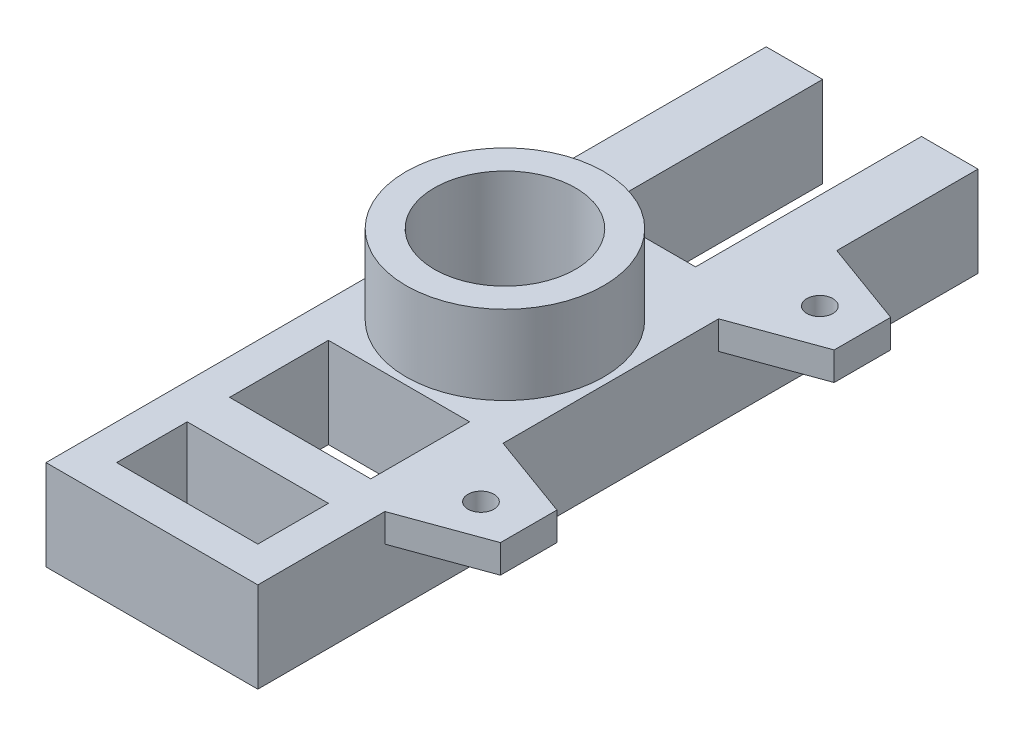
from build123d import *

# Parameters (mm, degrees)
SKETCH1_W           = 63.5
SKETCH1_H           = 31.75
SKETCH1_H_2         = 44.45
SKETCH1_R           = 44.45
BOSS_EXTRUDE1_DEPTH = 40.64
SKETCH1_3_R         = 44.45
SKETCH1_3_R_2       = 31.75
BOSS_EXTRUDE2_DEPTH = 76.2
SKETCH2_W           = 203.2
SKETCH2_H           = 12.7
BOSS_EXTRUDE3_DEPTH = 50.8
SKETCH3_R           = 5.842
CUT_EXTRUDE1_DEPTH  = 197.461447172


with BuildPart() as part:
    # Sketch1 → Boss-Extrude1 (new body)
    with BuildSketch(Plane(origin=(0, 0, 0), x_dir=(1, 0, 0), z_dir=(0, 1, 0))):
        Polygon((-47.625, 63.5), (-47.625, -95.25), (-47.625, -158.75), (47.625, -158.75), (47.625, -95.25), (47.625, 63.5), (47.625, 165.1), (22.225, 165.1), (22.225, 63.5), (-22.225, 63.5), (-22.225, 165.1), (-47.625, 165.1), align=None)
        with Locations((0, -127)):
            Rectangle(SKETCH1_W, SKETCH1_H, mode=Mode.SUBTRACT)
        with Locations((0, -69.85)):
            Rectangle(SKETCH1_W, SKETCH1_H_2, mode=Mode.SUBTRACT)
        Circle(SKETCH1_R, mode=Mode.SUBTRACT)
    extrude(amount=BOSS_EXTRUDE1_DEPTH)

    # Sketch1<3> → Boss-Extrude2 (add)
    with BuildSketch(Plane(origin=(0, 0, 0), x_dir=(1, 0, 0), z_dir=(0, 1, 0))):
        Circle(SKETCH1_3_R)
        Circle(SKETCH1_3_R_2, mode=Mode.SUBTRACT)
    extrude(amount=BOSS_EXTRUDE2_DEPTH)

    # Sketch2 → Boss-Extrude3 (add)
    with BuildSketch(Plane(origin=(47.625, 0, 0), x_dir=(0, 0, -1), z_dir=(1, 0, 0))):
        with Locations((0, 34.29)):
            Rectangle(SKETCH2_W, SKETCH2_H)
    extrude(amount=BOSS_EXTRUDE3_DEPTH)

    # Sketch3 → Cut-Extrude1 (cut, through all)
    with BuildSketch(Plane(origin=(0, 40.64, 0), x_dir=(1, 0, 0), z_dir=(0, 1, 0))):
        with Locations((65.405, 76.2)):
            Circle(SKETCH3_R)
        with Locations((65.405, -76.2)):
            Circle(SKETCH3_R)
        Polygon((47.625, 101.6), (85.725, 87.732734074), (85.725, 62.332734074), (47.625, 48.465468149), (47.625, -48.465468149), (85.725, -62.332734074), (85.725, -87.732734074), (47.625, -101.6), (98.425, -101.6), (98.425, 101.6), align=None)
    extrude(amount=-CUT_EXTRUDE1_DEPTH, mode=Mode.SUBTRACT)


solid = part.part
